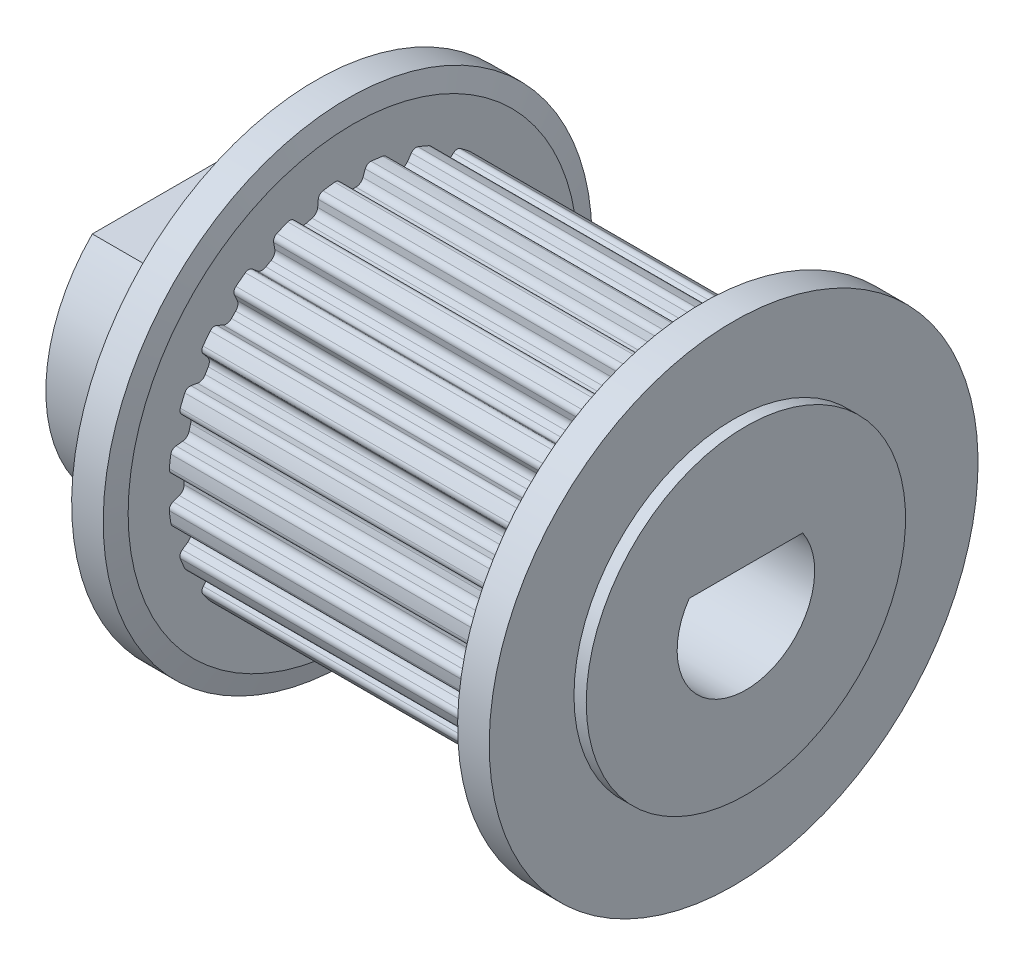
from build123d import *

# Parameters (mm, degrees)
CUT_EXTRUDE_3_DEPTH              = 7
FILLET_3_R                       = 0.23
FILLET_4_R                       = 0.3
PATTERN_CIRCULAR_2_COUNT         = 24
FILLET_3_OF_PATTERN_CIRCULAR_2_R = 0.23
FILLET_4_OF_PATTERN_CIRCULAR_2_R = 0.3
SKETCH_7_R                       = 2.5
CUT_EXTRUDE_4_DEPTH              = 23.847428739
SKETCH2_R                        = 2.5
CUT_EXTRUDE1_DEPTH               = 23.847428739
SKETCH3_R                        = 6.5
BOSS_EXTRUDE1_DEPTH              = 4
CUT_EXTRUDE2_DEPTH               = 27.115225444
BOSS_EXTRUDE2_DEPTH              = 22
CUT_EXTRUDE3_START               = -4.5
CUT_EXTRUDE3_DEPTH               = 4.5
SKETCH7_R                        = 0.353345367
CUT_EXTRUDE4_DEPTH               = 0.1


with BuildPart() as part:
    # 草图1 → 旋转1 (revolve)
    with BuildSketch(Plane.XY, mode=Mode.PRIVATE) as revolve_1_sk:
        Polygon((-9, 6.5), (-7, 6.5), (-7, 7.51), (7, 7.51), (7, 6.5), (9, 6.5), (9, 0), (-9, 0), align=None)
    revolve(revolve_1_sk.sketch.rotate(Axis((-9, 0, 0), (1, 0, 0)), 90), axis=Axis((-9, 0, 0), (1, 0, 0)))

    # 草图3 → 切除-拉伸3 (cut, symmetric)
    with BuildSketch(Plane(origin=(0, 0, 0), x_dir=(0, 0, -1), z_dir=(1, 0, 0))):
        with BuildLine():
            Line((-0.335, 6.861827381), (-0.563217845, 7.488850757))
            ThreePointArc((-0.563217845, 7.488850757), (0, 7.51), (0.563217845, 7.488850757))
            Line((0.563217845, 7.488850757), (0.335, 6.861827381))
            ThreePointArc((0.335, 6.861827381), (0, 6.87), (-0.335, 6.861827381))
        make_face()
    cut_extrude_3 = extrude(amount=CUT_EXTRUDE_3_DEPTH, both=True, mode=Mode.SUBTRACT)

    # 圆角3
    fillet_3_edges = [part.edges().sort_by_distance(p)[0] for p in [
        (0, 7.488850757, 0.563217845),
        (0, 7.488850757, -0.563217845),
    ]]
    fillet(fillet_3_edges, radius=FILLET_3_R)

    # 圆角4
    fillet_4_edges = [part.edges().sort_by_distance(p)[0] for p in [
        (0, 6.861827381, -0.335),
        (0, 6.861827381, 0.335),
    ]]
    fillet(fillet_4_edges, radius=FILLET_4_R)

    # 阵列(圆周)2: 切除-拉伸3 ×24 about axis
    pattern_circular_2_axis = Axis((0, 0, 0), (1, 0, 0))
    for i in range(1, PATTERN_CIRCULAR_2_COUNT):
        add(cut_extrude_3.rotate(pattern_circular_2_axis, i * 360 / PATTERN_CIRCULAR_2_COUNT), mode=Mode.SUBTRACT)

    # 圆角3 of 阵列(圆周)2
    fillet_3_of_pattern_circular_2_edges = [part.edges().sort_by_distance(p)[0] for p in [
        (0, 7.08790285, 2.482283864),
        (0, 7.37944586, 1.394230539),
        (0, 6.203926078, 4.23218634),
        (0, 6.767143923, 3.256664417),
        (0, 4.897161996, 5.693672311),
        (0, 5.693672311, 4.897161996),
        (0, 3.256664417, 6.767143923),
        (0, 4.23218634, 6.203926078),
        (0, 1.394230539, 7.37944586),
        (0, 2.482283864, 7.08790285),
        (0, -0.563217845, 7.488850757),
        (0, 0.563217845, 7.488850757),
        (0, -2.482283864, 7.08790285),
        (0, -1.394230539, 7.37944586),
        (0, -4.23218634, 6.203926078),
        (0, -3.256664417, 6.767143923),
        (0, -5.693672311, 4.897161996),
        (0, -4.897161996, 5.693672311),
        (0, -6.767143923, 3.256664417),
        (0, -6.203926078, 4.23218634),
        (0, -7.37944586, 1.394230539),
        (0, -7.08790285, 2.482283864),
        (0, -7.488850757, -0.563217845),
        (0, -7.488850757, 0.563217845),
        (0, -7.08790285, -2.482283864),
        (0, -7.37944586, -1.394230539),
        (0, -6.203926078, -4.23218634),
        (0, -6.767143923, -3.256664417),
        (0, -4.897161996, -5.693672311),
        (0, -5.693672311, -4.897161996),
        (0, -3.256664417, -6.767143923),
        (0, -4.23218634, -6.203926078),
        (0, -1.394230539, -7.37944586),
        (0, -2.482283864, -7.08790285),
        (0, 0.563217845, -7.488850757),
        (0, -0.563217845, -7.488850757),
        (0, 2.482283864, -7.08790285),
        (0, 1.394230539, -7.37944586),
        (0, 4.23218634, -6.203926078),
        (0, 3.256664417, -6.767143923),
        (0, 5.693672311, -4.897161996),
        (0, 4.897161996, -5.693672311),
        (0, 6.767143923, -3.256664417),
        (0, 6.203926078, -4.23218634),
        (0, 7.37944586, -1.394230539),
        (0, 7.08790285, -2.482283864),
    ]]
    fillet(fillet_3_of_pattern_circular_2_edges, radius=FILLET_3_OF_PATTERN_CIRCULAR_2_R)

    # 圆角4 of 阵列(圆周)2
    fillet_4_of_pattern_circular_2_edges = [part.edges().sort_by_distance(p)[0] for p in [
        (0, 6.714720662, 1.452386458),
        (0, 6.541311902, 2.099556762),
        (0, 6.110016828, 3.14079518),
        (0, 5.775016828, 3.721032201),
        (0, 5.088925444, 4.6151639),
        (0, 4.6151639, 5.088925444),
        (0, 3.721032201, 5.775016828),
        (0, 3.14079518, 6.110016828),
        (0, 2.099556762, 6.541311902),
        (0, 1.452386458, 6.714720662),
        (0, 0.335, 6.861827381),
        (0, -0.335, 6.861827381),
        (0, -1.452386458, 6.714720662),
        (0, -2.099556762, 6.541311902),
        (0, -3.14079518, 6.110016828),
        (0, -3.721032201, 5.775016828),
        (0, -4.6151639, 5.088925444),
        (0, -5.088925444, 4.6151639),
        (0, -5.775016828, 3.721032201),
        (0, -6.110016828, 3.14079518),
        (0, -6.541311902, 2.099556762),
        (0, -6.714720662, 1.452386458),
        (0, -6.861827381, 0.335),
        (0, -6.861827381, -0.335),
        (0, -6.714720662, -1.452386458),
        (0, -6.541311902, -2.099556762),
        (0, -6.110016828, -3.14079518),
        (0, -5.775016828, -3.721032201),
        (0, -5.088925444, -4.6151639),
        (0, -4.6151639, -5.088925444),
        (0, -3.721032201, -5.775016828),
        (0, -3.14079518, -6.110016828),
        (0, -2.099556762, -6.541311902),
        (0, -1.452386458, -6.714720662),
        (0, -0.335, -6.861827381),
        (0, 0.335, -6.861827381),
        (0, 1.452386458, -6.714720662),
        (0, 2.099556762, -6.541311902),
        (0, 3.14079518, -6.110016828),
        (0, 3.721032201, -5.775016828),
        (0, 4.6151639, -5.088925444),
        (0, 5.088925444, -4.6151639),
        (0, 5.775016828, -3.721032201),
        (0, 6.110016828, -3.14079518),
        (0, 6.541311902, -2.099556762),
        (0, 6.714720662, -1.452386458),
    ]]
    fillet(fillet_4_of_pattern_circular_2_edges, radius=FILLET_4_OF_PATTERN_CIRCULAR_2_R)

    # 草图4 → 旋转2 (revolve)
    with BuildSketch(Plane.XY, mode=Mode.PRIVATE) as revolve_2_sk:
        Polygon((-8.5, 9.95), (-8.5, 6.5), (-7, 6.5), (-7, 9.15), (-7.214359354, 9.95), align=None)
        Polygon((8.5, 9.95), (8.5, 6.5), (7, 6.5), (7, 9.15), (7.214359354, 9.95), align=None)
    revolve(revolve_2_sk.sketch.rotate(Axis((-9, 0, 0), (1, 0, 0)), 180), axis=Axis((-9, 0, 0), (1, 0, 0)))

    # 草图7 → 切除-拉伸4 (cut, through all)
    with BuildSketch(Plane.ZY.offset(9)):
        Circle(SKETCH_7_R)
    extrude(amount=-CUT_EXTRUDE_4_DEPTH, mode=Mode.SUBTRACT)

    # Sketch2 → Cut-Extrude1 (cut, through all)
    # profile 1 of 2: a face of its own
    with BuildSketch(Plane.ZY.offset(9)):
        with BuildLine():
            ThreePointArc((2.403330659, 1.436663407), (-0.001151247, 2.799999763), (-2.404511242, 1.434686617))
            ThreePointArc((-2.404511242, 1.434686617), (0.001151247, -2.799999763), (2.403330659, 1.436663407))
        make_face()
        Circle(SKETCH2_R, mode=Mode.SUBTRACT)
    # profile 2 of 2: a face of its own
    with BuildSketch(Plane.ZY.offset(9)):
        Circle(SKETCH2_R)
    extrude(amount=-CUT_EXTRUDE1_DEPTH, mode=Mode.SUBTRACT)

    # Sketch3 → Boss-Extrude1 (add)
    with BuildSketch(Plane.ZY.offset(9)):
        Circle(SKETCH3_R)
    extrude(amount=BOSS_EXTRUDE1_DEPTH)

    # Sketch4 → Cut-Extrude2 (cut, through all)
    with BuildSketch(Plane.ZY.offset(13)):
        with BuildLine():
            ThreePointArc((-2.404511242, 1.434686617), (0.001151247, -2.799999763), (2.403330659, 1.436663407))
            ThreePointArc((2.403330659, 1.436663407), (-0.001151247, 2.799999763), (-2.404511242, 1.434686617))
        make_face()
    extrude(amount=-CUT_EXTRUDE2_DEPTH, mode=Mode.SUBTRACT)

    # Sketch5 → Boss-Extrude2 (add)
    with BuildSketch(Plane.ZY.offset(13)):
        with BuildLine():
            Line((2.309704736, 1.582802589), (-2.311005523, 1.580902739))
            ThreePointArc((-2.311005523, 1.580902739), (-0.001151247, 2.799999763), (2.309704736, 1.582802589))
        make_face()
    extrude(amount=-BOSS_EXTRUDE2_DEPTH)

    # Sketch6 → Cut-Extrude3 (cut)
    with BuildSketch(Plane.ZY.offset(13).offset(CUT_EXTRUDE3_START)):
        with BuildLine():
            Line((4.608606486, 4.583748058), (-4.612374231, 4.579956763))
            ThreePointArc((-4.612374231, 4.579956763), (-0.002672537, 6.499999451), (4.608606486, 4.583748058))
        make_face()
    extrude(amount=CUT_EXTRUDE3_DEPTH, mode=Mode.SUBTRACT)

    # Sketch7 → Cut-Extrude4 (cut)
    with BuildSketch(Plane(origin=(0, 4.58185241, -0.001883873), x_dir=(1, 0, 0), z_dir=(0, 0.9999999154739085, -0.0004111595506967824))):
        with Locations(Location((-10.858136016, 0, 0), (0, 0, 270))):
            Circle(SKETCH7_R)
    extrude(amount=-CUT_EXTRUDE4_DEPTH, mode=Mode.SUBTRACT)


solid = part.part
